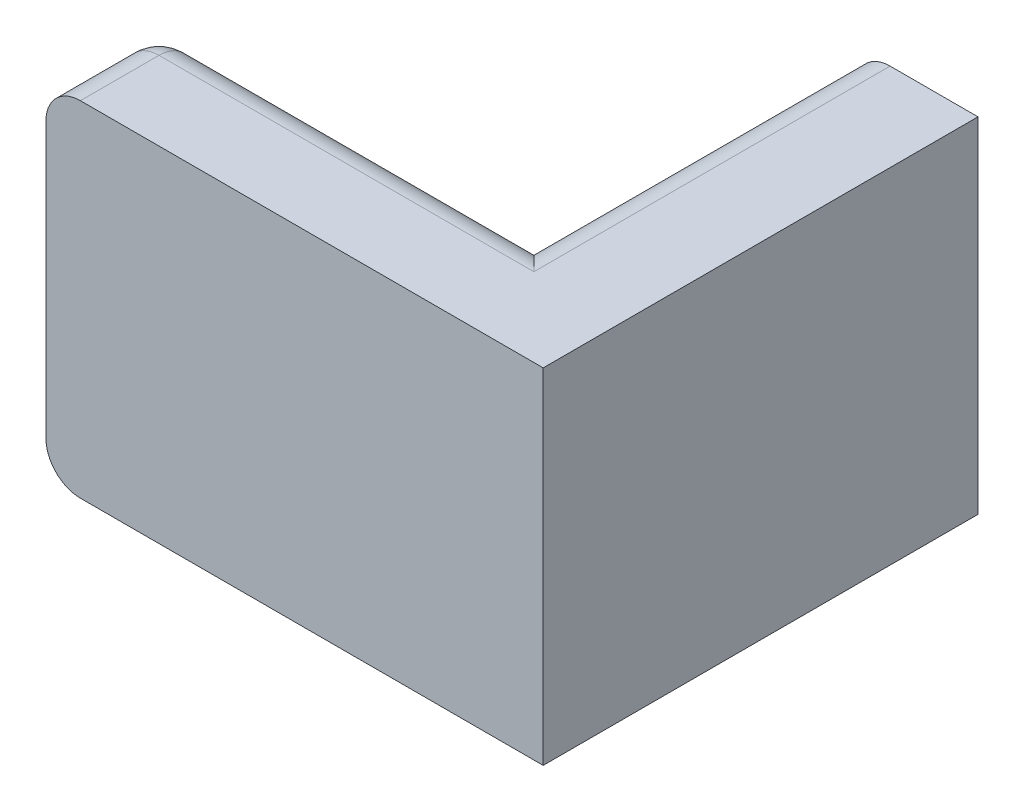
from build123d import *

# Parameters (mm, degrees)
BOSS_EXTRUDE1_DEPTH = 50
FILLET2_R           = 5


with BuildPart() as part:
    # Sketch1 → Boss-Extrude1 (new body)
    with BuildSketch(Plane(origin=(0, 0, 0), x_dir=(1, 0, 0), z_dir=(0, 1, 0))):
        Polygon((0, 0), (72.207221558, 0), (72.207221558, 63.147853309), (54.440853042, 63.147853309), (54.440853042, 16.414579606), (0, 16.414579606), align=None)
    extrude(amount=BOSS_EXTRUDE1_DEPTH)

    # Fillet2
    fillet2_edges = [part.edges().sort_by_distance(p)[0] for p in [
        (0, 25, -16.414579606),
        (54.440853042, 50, -39.781216458),
        (27.220426521, 50, -16.414579606),
        (0, 50, -8.207289803),
        (27.220426521, 0, -16.414579606),
        (54.440853042, 0, -39.781216458),
        (0, 0, -8.207289803),
    ]]
    fillet(fillet2_edges, radius=FILLET2_R)


solid = part.part
